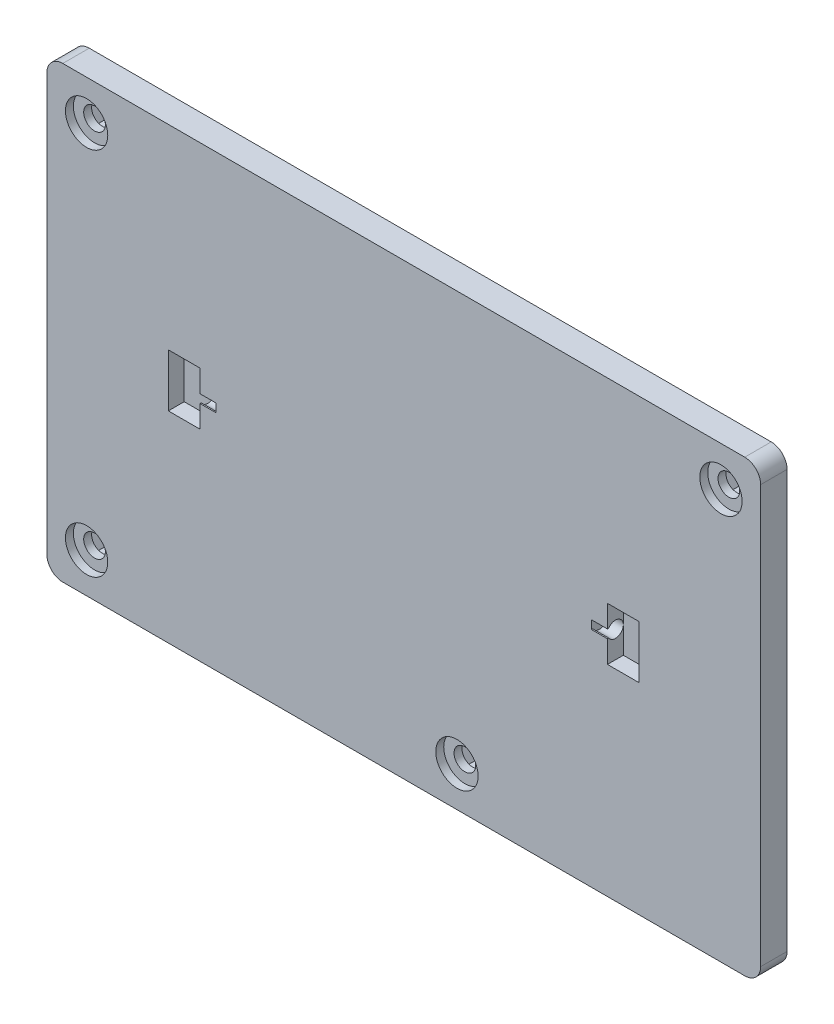
from build123d import *

# Parameters (mm, degrees)
EXTRUDE_1_DEPTH     = 5
CUT_EXTRUDE_1_DEPTH = 2
SKETCH_3_R          = 2.05
CUT_EXTRUDE_2_DEPTH = 3
SKETCH_4_R          = 4
CUT_EXTRUDE_3_DEPTH = 1.5
SKETCH_5_W          = 6
SKETCH_5_H          = 10
CUT_EXTRUDE_4_DEPTH = 3
CUT_EXTRUDE_5_DEPTH = 3
CUT_EXTRUDE_START   = -3
CUT_EXTRUDE_6_DEPTH = 3


with BuildPart() as part:
    # 草图1 → 凸台-拉伸1 (new body)
    with BuildSketch(Plane.XY):
        with BuildLine():
            Line((-64.45, 0), (64.45, 0))
            ThreePointArc((64.45, 0), (66.571320344, 0.878679656), (67.45, 3))
            Line((67.45, 3), (67.45, 81.9))
            ThreePointArc((67.45, 81.9), (66.571320344, 84.021320344), (64.45, 84.9))
            Line((64.45, 84.9), (-64.45, 84.9))
            ThreePointArc((-64.45, 84.9), (-66.571320344, 84.021320344), (-67.45, 81.9))
            Line((-67.45, 81.9), (-67.45, 3))
            ThreePointArc((-67.45, 3), (-66.571320344, 0.878679656), (-64.45, 0))
        make_face()
    extrude(amount=EXTRUDE_1_DEPTH)

    # 草图2 → 切除-拉伸1 (cut)
    with BuildSketch(Plane(origin=(0, 0, 0), x_dir=(-1, 0, 0), z_dir=(0, 0, -1))):
        Polygon((-56.659103466, 77.4), (-58.304551733, 80.25), (-61.595448267, 80.25), (-63.240896534, 77.4), (-61.595448267, 74.55), (-58.304551733, 74.55), align=None)
        Polygon((58.304551733, 74.55), (56.659103466, 77.4), (58.304551733, 80.25), (61.595448267, 80.25), (63.240896534, 77.4), (61.595448267, 74.55), align=None)
        Polygon((-13.340896534, 7.5), (-11.695448267, 4.65), (-8.404551733, 4.65), (-6.759103466, 7.5), (-8.404551733, 10.35), (-11.695448267, 10.35), align=None)
        Polygon((56.659103466, 7.5), (58.304551733, 4.65), (61.595448267, 4.65), (63.240896534, 7.5), (61.595448267, 10.35), (58.304551733, 10.35), align=None)
    extrude(amount=-CUT_EXTRUDE_1_DEPTH, mode=Mode.SUBTRACT)

    # 草图3 → 切除-拉伸2 (cut)
    with BuildSketch(Plane(origin=(0, 0, 2), x_dir=(-1, 0, 0), z_dir=(0, 0, -1))):
        with Locations((-59.95, 77.4)):
            Circle(SKETCH_3_R)
        with Locations(Location((59.95, 77.4, 0), (0, 0, 180))):
            Circle(SKETCH_3_R)
        with Locations((-10.05, 7.5)):
            Circle(SKETCH_3_R)
        with Locations((59.95, 7.5)):
            Circle(SKETCH_3_R)
    extrude(amount=-CUT_EXTRUDE_2_DEPTH, mode=Mode.SUBTRACT)

    # 草图4 → 切除-拉伸3 (cut)
    with BuildSketch(Plane.XY.offset(5)):
        with Locations((-59.95, 77.4)):
            Circle(SKETCH_4_R)
        with Locations((59.95, 77.4)):
            Circle(SKETCH_4_R)
        with Locations(Location((-59.95, 7.5, 0), (0, 0, 180))):
            Circle(SKETCH_4_R)
        with Locations(Location((10.05, 7.5, 0), (0, 0, 180))):
            Circle(SKETCH_4_R)
    extrude(amount=-CUT_EXTRUDE_3_DEPTH, mode=Mode.SUBTRACT)

    # 草图5 → 切除-拉伸4 (cut)
    with BuildSketch(Plane.XY.offset(5)):
        with Locations((-41.5, 43)):
            Rectangle(SKETCH_5_W, SKETCH_5_H)
        with Locations((41.5, 43)):
            Rectangle(SKETCH_5_W, SKETCH_5_H)
    extrude(amount=-CUT_EXTRUDE_4_DEPTH, mode=Mode.SUBTRACT)

    # 草图6 → 切除-拉伸5 (cut)
    with BuildSketch(Plane(origin=(38.5, 0, 0), x_dir=(0, 0, -1), z_dir=(1, 0, 0))):
        with BuildLine():
            Line((-4.768857754, 43.8), (-5, 43.8))
            Line((-5, 43.8), (-5, 42.2))
            Line((-5, 42.2), (-4.768857754, 42.2))
            ThreePointArc((-4.768857754, 42.2), (-2, 43), (-4.768857754, 43.8))
        make_face()
    extrude(amount=-CUT_EXTRUDE_5_DEPTH, mode=Mode.SUBTRACT)

    # 草图7 → 切除-拉伸6 (cut)
    with BuildSketch(Plane.ZY.offset(38.5).offset(CUT_EXTRUDE_START)):
        with BuildLine():
            Line((5, 43.8), (4.768857754, 43.8))
            ThreePointArc((4.768857754, 43.8), (2, 43), (4.768857754, 42.2))
            Line((4.768857754, 42.2), (5, 42.2))
            Line((5, 42.2), (5, 43.8))
        make_face()
    extrude(amount=CUT_EXTRUDE_6_DEPTH, mode=Mode.SUBTRACT)


solid = part.part
